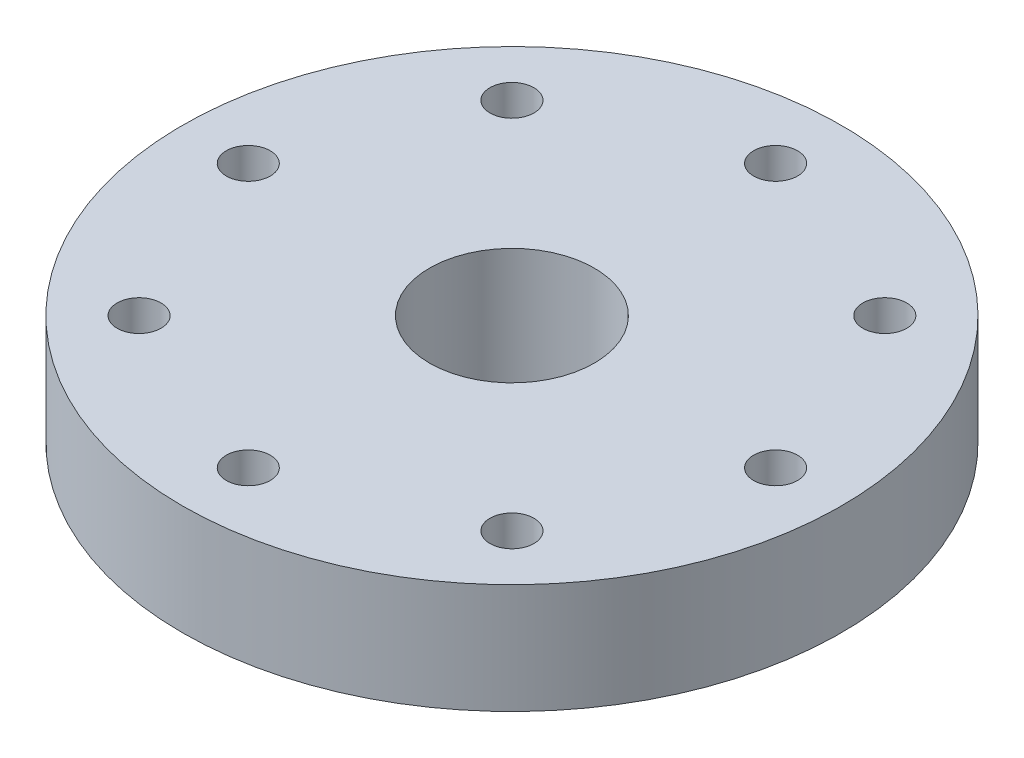
from build123d import *

# Parameters (mm, degrees)
SKETCH1_R           = 6
BOSS_EXTRUDE1_DEPTH = 1.3
SKETCH2_R           = 15
SKETCH2_R_2         = 1
BOSS_EXTRUDE2_DEPTH = 5
SKETCH3_R           = 2
CUT_EXTRUDE1_DEPTH  = 23.128940327
SKETCH4_R           = 3.75
CUT_EXTRUDE2_DEPTH  = 5.6


with BuildPart() as part:
    # Sketch1 → Boss-Extrude1 (new body)
    with BuildSketch(Plane(origin=(0, 0, 0), x_dir=(1, 0, 0), z_dir=(0, 1, 0))):
        with Locations(Location((0, 0, 0), (0, 0, 270))):
            Circle(SKETCH1_R)
    extrude(amount=BOSS_EXTRUDE1_DEPTH)

    # Sketch2 → Boss-Extrude2 (add)
    with BuildSketch(Plane(origin=(0, 1.3, 0), x_dir=(1, 0, 0), z_dir=(0, 1, 0))):
        with Locations(Location((0, 0, 0), (0, 0, 270))):
            Circle(SKETCH2_R)
        with Locations(Location((0, 12, 0), (0, 0, 270))):
            Circle(SKETCH2_R_2, mode=Mode.SUBTRACT)
        with Locations(Location((8.485281374, 8.485281374, 0), (0, 0, 270))):
            Circle(SKETCH2_R_2, mode=Mode.SUBTRACT)
        with Locations(Location((12, 0, 0), (0, 0, 270))):
            Circle(SKETCH2_R_2, mode=Mode.SUBTRACT)
        with Locations(Location((8.485281374, -8.485281374, 0), (0, 0, 270))):
            Circle(SKETCH2_R_2, mode=Mode.SUBTRACT)
        with Locations(Location((0, -12, 0), (0, 0, 270))):
            Circle(SKETCH2_R_2, mode=Mode.SUBTRACT)
        with Locations(Location((-8.485281374, -8.485281374, 0), (0, 0, 270))):
            Circle(SKETCH2_R_2, mode=Mode.SUBTRACT)
        with Locations(Location((-12, 0, 0), (0, 0, 270))):
            Circle(SKETCH2_R_2, mode=Mode.SUBTRACT)
        with Locations(Location((-8.485281374, 8.485281374, 0), (0, 0, 270))):
            Circle(SKETCH2_R_2, mode=Mode.SUBTRACT)
    extrude(amount=BOSS_EXTRUDE2_DEPTH)

    # Sketch3 → Cut-Extrude1 (cut, through all)
    with BuildSketch(Plane.XZ):
        with Locations(Location((0, 0, 0), (0, 0, 270))):
            Circle(SKETCH3_R)
    extrude(amount=-CUT_EXTRUDE1_DEPTH, mode=Mode.SUBTRACT)

    # Sketch4 → Cut-Extrude2 (cut)
    with BuildSketch(Plane(origin=(0, 6.3, 0), x_dir=(1, 0, 0), z_dir=(0, 1, 0))):
        with Locations(Location((0, 0, 0), (0, 0, 270))):
            Circle(SKETCH4_R)
    extrude(amount=-CUT_EXTRUDE2_DEPTH, mode=Mode.SUBTRACT)


solid = part.part
